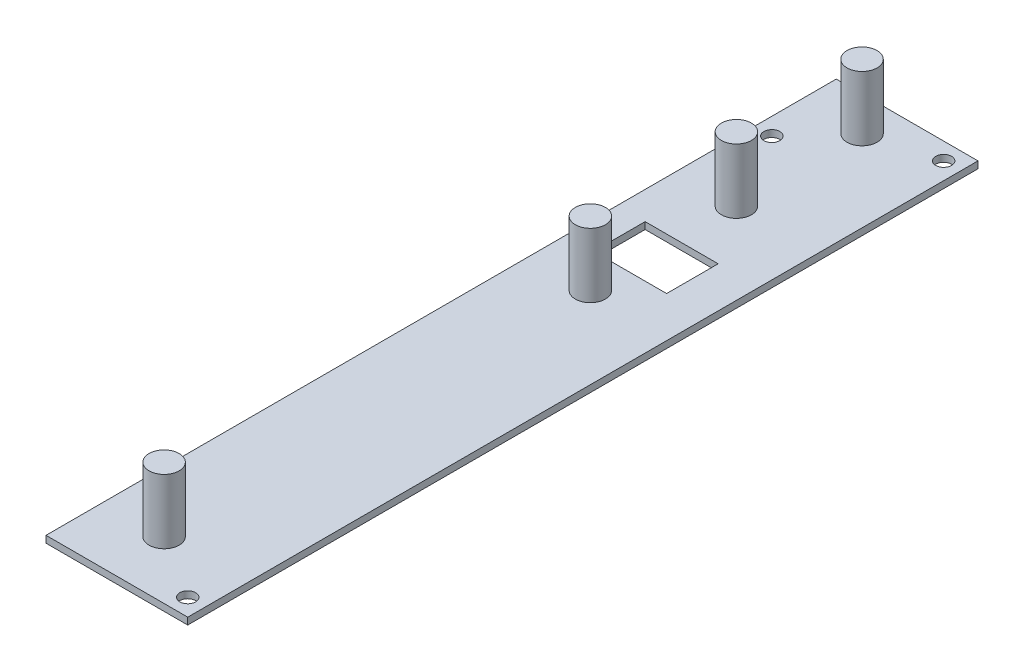
from build123d import *

# Parameters (mm, degrees)
SKETCH1_W           = 33
SKETCH1_H           = 184
BOSS_EXTRUDE1_DEPTH = 1.6
SKETCH2_R           = 1.85
CUT_EXTRUDE1_DEPTH  = 94.481602468
SKETCH3_R           = 3.5
BOSS_EXTRUDE2_DEPTH = 15
SKETCH4_W           = 17
SKETCH4_H           = 12
CUT_EXTRUDE2_DEPTH  = 95.663879067


with BuildPart() as part:
    # Sketch1 → Boss-Extrude1 (new body)
    with BuildSketch(Plane(origin=(0, 0, 0), x_dir=(1, 0, 0), z_dir=(0, 1, 0))):
        Rectangle(SKETCH1_W, SKETCH1_H)
    extrude(amount=BOSS_EXTRUDE1_DEPTH)

    # Sketch2 → Cut-Extrude1 (cut, through all)
    with BuildSketch(Plane(origin=(0, 1.6, 0), x_dir=(1, 0, 0), z_dir=(0, 1, 0))):
        with Locations(Location((-12.5, 73, 0), (0, 0, 270))):
            Circle(SKETCH2_R)
        with Locations(Location((12.5, 88, 0), (0, 0, 270))):
            Circle(SKETCH2_R)
        with Locations(Location((12.5, -88, 0), (0, 0, 270))):
            Circle(SKETCH2_R)
    extrude(amount=-CUT_EXTRUDE1_DEPTH, mode=Mode.SUBTRACT)

    # Sketch3 → Boss-Extrude2 (add)
    with BuildSketch(Plane(origin=(0, 1.6, 0), x_dir=(1, 0, 0), z_dir=(0, 1, 0))):
        with Locations(Location((-2.5, 84, 0), (0, 0, 270))):
            Circle(SKETCH3_R)
        with Locations(Location((-2.5, 54.75, 0), (0, 0, 270))):
            Circle(SKETCH3_R)
        with Locations(Location((-2.5, 20.75, 0), (0, 0, 270))):
            Circle(SKETCH3_R)
        with Locations(Location((-2.5, -78.5, 0), (0, 0, 270))):
            Circle(SKETCH3_R)
    extrude(amount=BOSS_EXTRUDE2_DEPTH)

    # Sketch4 → Cut-Extrude2 (cut, through all)
    with BuildSketch(Plane(origin=(0, 1.6, 0), x_dir=(1, 0, 0), z_dir=(0, 1, 0))):
        with Locations((-1.5, 35)):
            Rectangle(SKETCH4_W, SKETCH4_H)
    extrude(amount=-CUT_EXTRUDE2_DEPTH, mode=Mode.SUBTRACT)


solid = part.part
